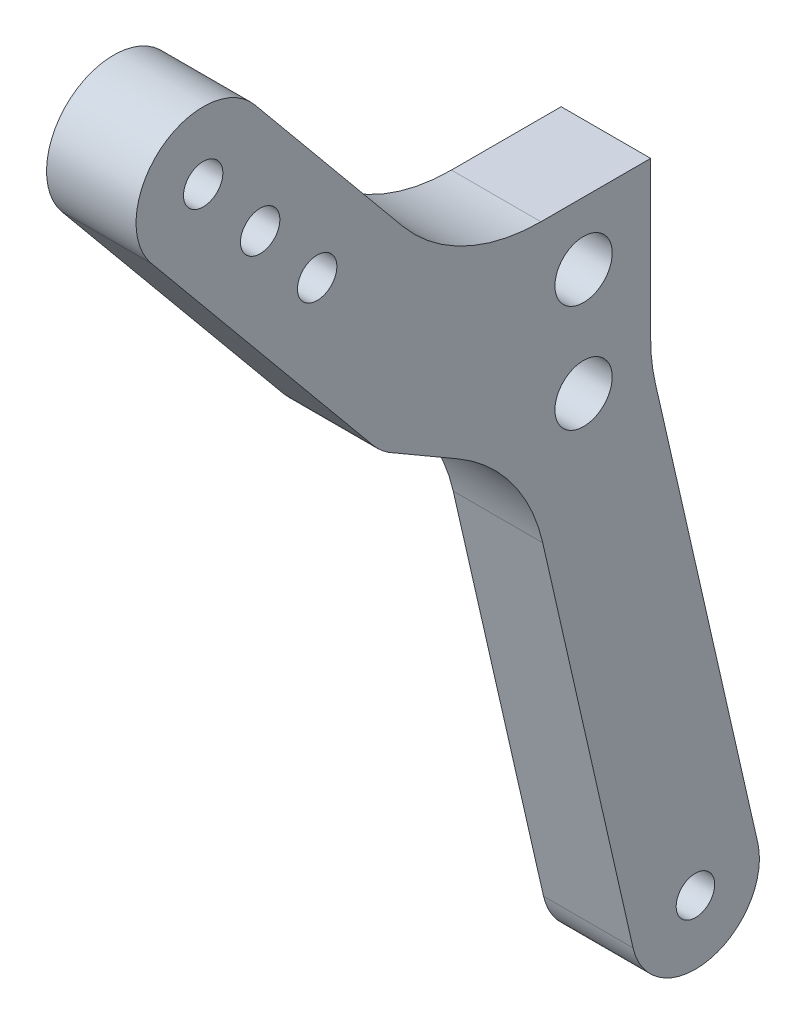
from build123d import *

# Parameters (mm, degrees)
SKETCH1_W           = 5
SKETCH1_H           = 7.5
BOSS_EXTRUDE1_DEPTH = 13
BOSS_EXTRUDE4_DEPTH = 5
SKETCH2_R           = 1.1
CUT_EXTRUDE1_DEPTH  = 35.686092314
LPATTERN1_COUNT     = 3
LPATTERN1_PITCH     = 5
SKETCH3_R           = 1.6
CUT_EXTRUDE2_DEPTH  = 35.686092314
BOSS_EXTRUDE2_DEPTH = 5
LPATTERN2_COUNT     = 2
LPATTERN2_PITCH     = 6
SKETCH5_R           = 1.075
SKETCH5_R_2         = 1.6
BOSS_EXTRUDE3_DEPTH = 5
FILLET2_R           = 10


with BuildPart() as part:
    # Sketch1 → Boss-Extrude1 (new body)
    with BuildSketch(Plane.XY):
        Rectangle(SKETCH1_W, SKETCH1_H)
    extrude(amount=BOSS_EXTRUDE1_DEPTH)

    # Sketch6 → Boss-Extrude4 (add)
    with BuildSketch(Plane(origin=(2.5, 0, 0), x_dir=(0, 0, -1), z_dir=(1, 0, 0))):
        with BuildLine():
            Line((-15.501719728, -2.388104729), (-27.89127235, 12.611895271))
            ThreePointArc((-27.89127235, 12.611895271), (-27.388104729, 17.89127235), (-22.10872765, 17.388104729))
            Line((-22.10872765, 17.388104729), (-9.719175027, 2.388104729))
            ThreePointArc((-9.719175027, 2.388104729), (-10.222342649, -2.89127235), (-15.501719728, -2.388104729))
        make_face()
    extrude(amount=-BOSS_EXTRUDE4_DEPTH)

    # Sketch2 → Cut-Extrude1 (cut, through all)
    with BuildSketch(Plane(origin=(2.5, 0, 0), x_dir=(0, 0, -1), z_dir=(1, 0, 0))):
        with Locations((-25, 15)):
            Circle(SKETCH2_R)
    cut_extrude1 = extrude(amount=-CUT_EXTRUDE1_DEPTH, mode=Mode.SUBTRACT)

    # LPattern1: Cut-Extrude1 ×3
    with Locations(*[Vector(0, -0.7710059601120912, -0.6368279276787667) * (i * LPATTERN1_PITCH) for i in range(1, LPATTERN1_COUNT)]):
        add(cut_extrude1, mode=Mode.SUBTRACT)

    # Sketch3 → Cut-Extrude2 (cut, through all)
    with BuildSketch(Plane(origin=(2.5, 0, 0), x_dir=(0, 0, -1), z_dir=(1, 0, 0))):
        with Locations((-3.75, 0.25)):
            Circle(SKETCH3_R)
    cut_extrude2 = extrude(amount=-CUT_EXTRUDE2_DEPTH, mode=Mode.SUBTRACT)

    # Sketch4 → Boss-Extrude2 (add)
    with BuildSketch(Plane(origin=(2.5, 0, 0), x_dir=(0, 0, -1), z_dir=(1, 0, 0))):
        Polygon((0, -3.75), (0, -8.75), (-5, -8.75), (-14.382714397, -3.304779813), align=None)
    extrude(amount=-BOSS_EXTRUDE2_DEPTH)

    # LPattern2: Cut-Extrude2 ×2
    with Locations(*[(0, -i * LPATTERN2_PITCH, 0) for i in range(1, LPATTERN2_COUNT)]):
        add(cut_extrude2, mode=Mode.SUBTRACT)

    # Sketch5 → Boss-Extrude3 (add)
    with BuildSketch(Plane(origin=(2.5, 0, 0), x_dir=(0, 0, -1), z_dir=(1, 0, 0))):
        with BuildLine():
            Line((-0.985537893, -33.954911928), (-7.235537893, -6.544764489))
            ThreePointArc((-7.235537893, -6.544764489), (-4.544764489, -2.264462107), (-0.264462107, -4.955235511))
            Line((-0.264462107, -4.955235511), (5.985537893, -32.365382949))
            ThreePointArc((5.985537893, -32.365382949), (3.294764489, -36.645685332), (-0.985537893, -33.954911928))
        make_face()
        with Locations((2.5, -33.160147439)):
            Circle(SKETCH5_R, mode=Mode.SUBTRACT)
        with Locations((-3.75, -5.75)):
            Circle(SKETCH5_R_2, mode=Mode.SUBTRACT)
    extrude(amount=-BOSS_EXTRUDE3_DEPTH)

    # Fillet2
    fillet2_edges = [part.edges().sort_by_distance(p)[0] for p in [
        (0, 3.75, 10.844059902),
        (0, -7.591071621, 6.996961301),
        (0, -6.115066764, 0),
    ]]
    fillet(fillet2_edges, radius=FILLET2_R)


solid = part.part
